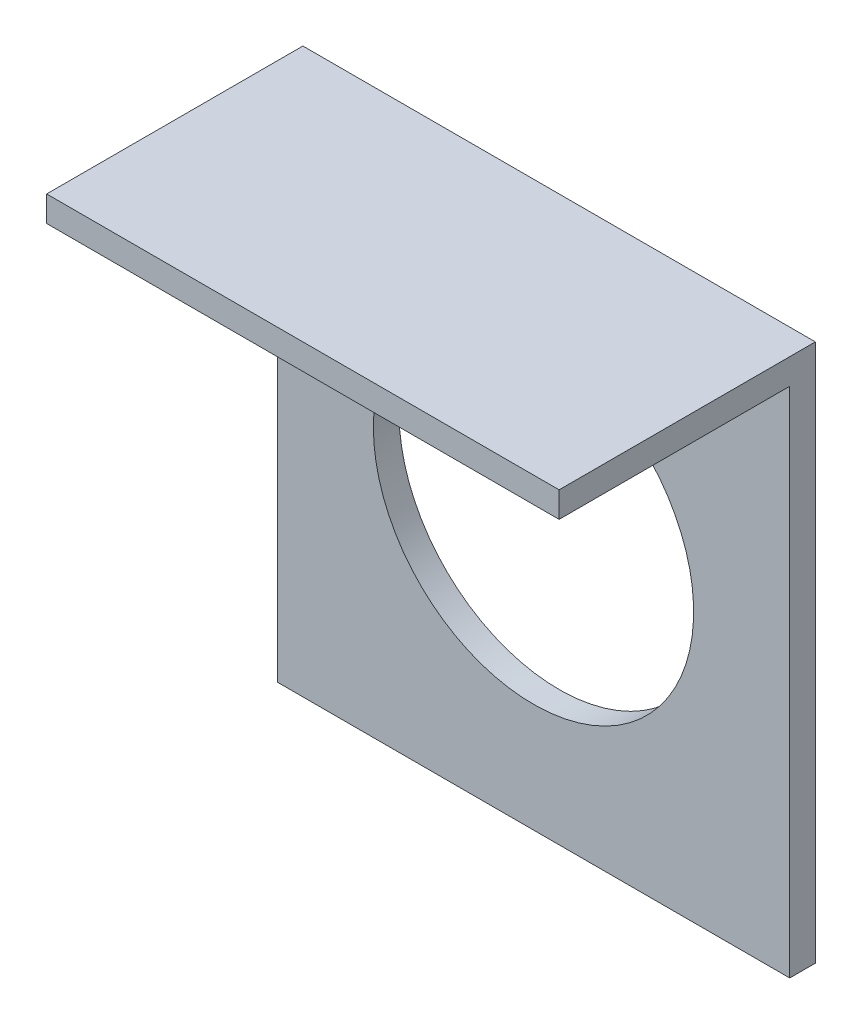
from build123d import *

# Parameters (mm, degrees)
SKETCH1_W           = 40
SKETCH1_H           = 42
SKETCH1_R           = 12.5
BOSS_EXTRUDE1_DEPTH = 2
SKETCH3_W           = 40
SKETCH3_H           = 2
BOSS_EXTRUDE2_DEPTH = 18
BOSS_EXTRUDE3_START = -2
SKETCH4_R           = 12.5
BOSS_EXTRUDE3_DEPTH = 2
SKETCH5_R           = 12.5
CUT_EXTRUDE1_DEPTH  = 2


with BuildPart() as part:
    # Sketch1 → Boss-Extrude1 (new body)
    with BuildSketch(Plane.XY):
        Rectangle(SKETCH1_W, SKETCH1_H)
        Circle(SKETCH1_R, mode=Mode.SUBTRACT)
    extrude(amount=BOSS_EXTRUDE1_DEPTH)

    # Sketch3 → Boss-Extrude2 (add)
    with BuildSketch(Plane.XY.offset(2)):
        with Locations((0, 20)):
            Rectangle(SKETCH3_W, SKETCH3_H)
    extrude(amount=BOSS_EXTRUDE2_DEPTH)

    # Sketch4 → Boss-Extrude3 (add)
    with BuildSketch(Plane.XY.offset(2).offset(BOSS_EXTRUDE3_START)):
        Circle(SKETCH4_R)
    extrude(amount=BOSS_EXTRUDE3_DEPTH)

    # Sketch5 → Cut-Extrude1 (cut)
    with BuildSketch(Plane(origin=(0, 0, 0), x_dir=(-1, 0, 0), z_dir=(0, 0, -1))):
        Circle(SKETCH5_R)
    extrude(amount=-CUT_EXTRUDE1_DEPTH, mode=Mode.SUBTRACT)


solid = part.part
